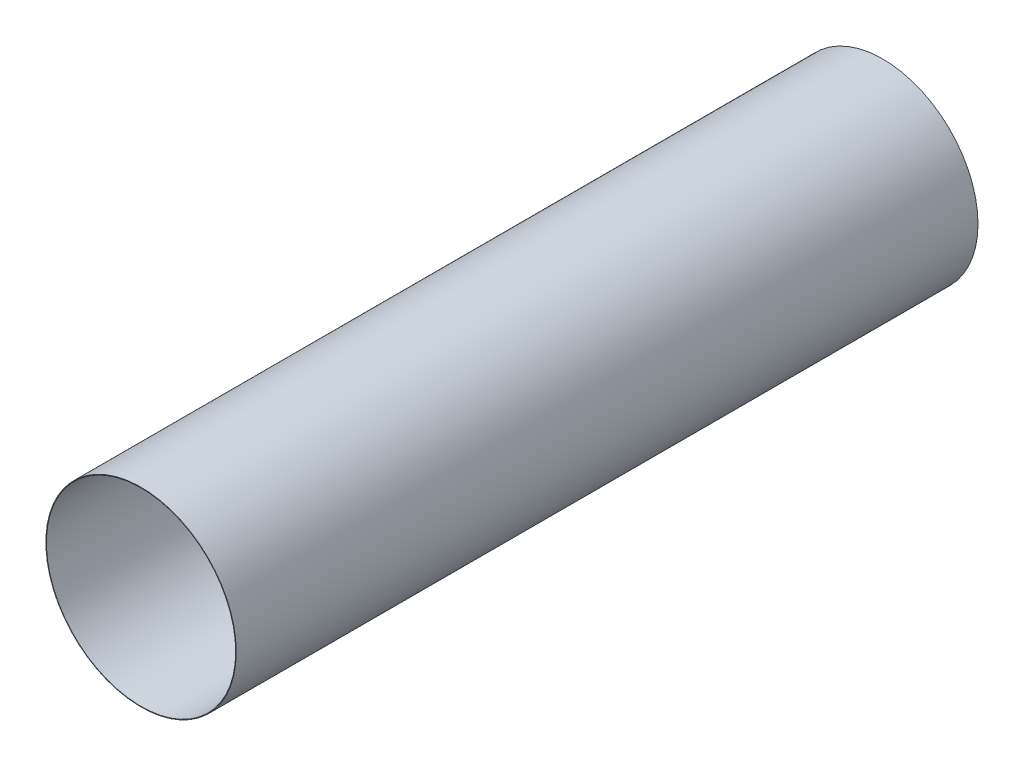
from build123d import *

# Parameters (mm, degrees)
SKETCH2_W = 1181.1
SKETCH2_H = 0.85


with BuildPart() as part:
    # Sketch2 → Revolve1 (revolve)
    with BuildSketch(Plane(origin=(0, 0, 0), x_dir=(0, 0, -1), z_dir=(1, 0, 0)), mode=Mode.PRIVATE) as revolve1_sk:
        with Locations((0, 151.170087811)):
            Rectangle(SKETCH2_W, SKETCH2_H)
    revolve(revolve1_sk.sketch.rotate(Axis((0, 0, 754.38), (0, 0, -1)), 90), axis=Axis((0, 0, 754.38), (0, 0, -1)))


solid = part.part
